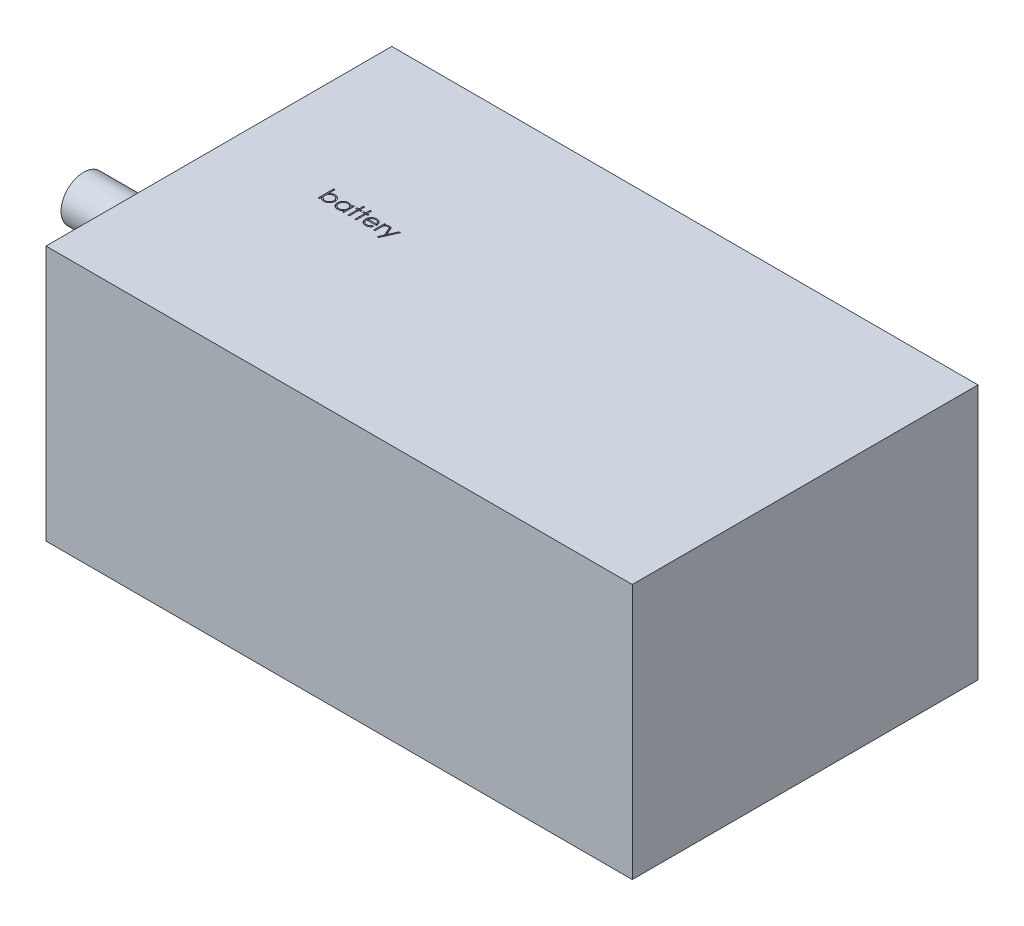
from build123d import *

# Parameters (mm, degrees)
SKETCH1_W           = 123.825
SKETCH1_H           = 73.025
BOSS_EXTRUDE1_DEPTH = 53.975
SKETCH2_R           = 4.7625
BOSS_EXTRUDE2_DEPTH = 31.75
CUT_EXTRUDE1_DEPTH  = 0.3175


with BuildPart() as part:
    # Sketch1 → Boss-Extrude1 (new body)
    with BuildSketch(Plane(origin=(0, 0, 0), x_dir=(1, 0, 0), z_dir=(0, 1, 0))):
        with Locations((61.9125, 36.5125)):
            Rectangle(SKETCH1_W, SKETCH1_H)
    extrude(amount=BOSS_EXTRUDE1_DEPTH)

    # Sketch2 → Boss-Extrude2 (add)
    with BuildSketch(Plane.ZY):
        with Locations((-39.6875, 26.9875)):
            Circle(SKETCH2_R)
    extrude(amount=BOSS_EXTRUDE2_DEPTH)

    # Sketch4 → Cut-Extrude1 (cut)
    # profile 1 of 7: a face of its own
    with BuildSketch(Plane(origin=(0, 53.975, 0), x_dir=(1, 0, 0), z_dir=(0, 1, 0))):
        with BuildLine():
            Line((19.930656416, 37.539911063), (19.930656416, 40.796321319))
            Line((19.930656416, 40.796321319), (20.215592314, 40.796321319))
            Line((20.215592314, 40.796321319), (20.215592314, 39.4390597))
            add(Edge.make_bspline(
                [(20.215592314, 39.4390597), (20.247699201, 39.476032967), (20.310341061, 39.548169335), (20.415366842, 39.642373989), (20.525499037, 39.722250164), (20.641575455, 39.788096143), (20.763761187, 39.838237201), (20.891425315, 39.874906083), (21.024894187, 39.897028488), (21.115898009, 39.899537712), (21.161986544, 39.900808498)],
                knots=[0, 0, 0, 0, 1.077089805, 2.101446609, 3.097517232, 4.067117542, 5.031729543, 5.997785507, 6.985986182, 8, 8, 8, 8], degree=3))
            add(Edge.make_bspline(
                [(21.161986544, 39.900808498), (21.202958684, 39.899683434), (21.283967586, 39.897458991), (21.403059248, 39.880554841), (21.517643433, 39.853142978), (21.627657771, 39.815140787), (21.73258892, 39.764719086), (21.83333535, 39.704356614), (21.9293809, 39.63247613), (22.019237832, 39.550290519), (22.102054429, 39.461067012), (22.174546492, 39.36565344), (22.235778359, 39.265436751), (22.286425317, 39.160752408), (22.325587629, 39.051172861), (22.352568115, 38.936805553), (22.369707186, 38.817762993), (22.371866409, 38.736743521), (22.372964108, 38.695555093)],
                knots=[0, 0, 0, 0, 1.034377878, 2.045141349, 3.03070803, 4.00595497, 4.978199603, 5.965204761, 6.967410914, 8.002051993, 9.036360596, 10.037508045, 11.022711142, 11.997267194, 12.969246472, 13.954813154, 14.960274251, 16, 16, 16, 16], degree=3))
            add(Edge.make_bspline(
                [(22.372964108, 38.695555093), (22.37184248, 38.655005791), (22.369630806, 38.575048954), (22.352738619, 38.457386578), (22.324847365, 38.344140044), (22.284968292, 38.235601982), (22.234835097, 38.131262489), (22.172141297, 38.03231098), (22.099741319, 37.937025623), (22.015983777, 37.848467043), (21.925347911, 37.766612459), (21.82836142, 37.695487138), (21.727467248, 37.634058037), (21.621092853, 37.58538488), (21.510813273, 37.546014045), (21.395447029, 37.518692997), (21.275646815, 37.502751725), (21.194258966, 37.500397175), (21.153082298, 37.499205934)],
                knots=[0, 0, 0, 0, 1.024244038, 2.01964794, 2.996620209, 3.965911562, 4.936179293, 5.91563013, 6.920572822, 7.955171681, 8.990768464, 10.002129126, 10.989675881, 11.969873457, 12.952483066, 13.943799762, 14.959703725, 16, 16, 16, 16], degree=3))
            add(Edge.make_bspline(
                [(21.153082298, 37.499205934), (21.105942517, 37.500512772), (21.013509627, 37.503075252), (20.878297567, 37.524319612), (20.750316447, 37.560479787), (20.628108385, 37.609067951), (20.513420379, 37.674861802), (20.405524279, 37.756465425), (20.305100506, 37.85522347), (20.245939537, 37.930572107), (20.215592314, 37.969222962)],
                knots=[0, 0, 0, 0, 1.035807596, 2.031038093, 2.998900396, 3.954262848, 4.914341711, 5.895762244, 6.92060972, 8, 8, 8, 8], degree=3))
            Line((20.215592314, 37.969222962), (20.215592314, 37.539911063))
            Line((20.215592314, 37.539911063), (19.930656416, 37.539911063))
        make_face()
        with BuildLine():
            add(Edge.make_bspline(
                [(21.150538227, 37.784141832), (21.192189104, 37.785623767), (21.27440131, 37.78854887), (21.395091034, 37.811384942), (21.51058321, 37.849379817), (21.620295863, 37.901344324), (21.722512096, 37.966678598), (21.813818414, 38.045732625), (21.894989294, 38.135994713), (21.962709119, 38.237806706), (22.019247926, 38.346165799), (22.058085684, 38.460152201), (22.084138574, 38.576715332), (22.086726016, 38.655769243), (22.088028211, 38.695555093)],
                knots=[0, 0, 0, 0, 1.031910345, 2.036826888, 3.032245421, 4.038315463, 5.03827337, 6.029480047, 7.023177075, 8.037597977, 9.052889626, 10.043399556, 11.015292101, 12, 12, 12, 12], degree=3))
            add(Edge.make_bspline(
                [(22.088028211, 38.695555093), (22.086315758, 38.735302049), (22.082897687, 38.814637281), (22.058971992, 38.93224805), (22.017190997, 39.046173967), (21.961748218, 39.156099713), (21.892925118, 39.258613932), (21.812183993, 39.350679976), (21.719762641, 39.430109391), (21.617415682, 39.496321812), (21.50839508, 39.550350835), (21.393650005, 39.587403108), (21.275577994, 39.611658464), (21.195390654, 39.614460745), (21.15499035, 39.615872601)],
                knots=[0, 0, 0, 0, 0.984795267, 1.965658976, 2.959410029, 3.983795688, 5.009594896, 6.01088574, 7.009236619, 8.019050059, 9.024672985, 10.014834719, 10.999826153, 12, 12, 12, 12], degree=3))
            add(Edge.make_bspline(
                [(21.15499035, 39.615872601), (21.113744826, 39.614461543), (21.031880829, 39.611660878), (20.911078227, 39.587360495), (20.793092248, 39.550124447), (20.680345701, 39.496665295), (20.575249523, 39.431249898), (20.481258081, 39.354378432), (20.400221597, 39.266585229), (20.333506891, 39.168154966), (20.280525395, 39.061851398), (20.242621566, 38.948447471), (20.219943315, 38.828540138), (20.217060295, 38.746322873), (20.215592314, 38.70445934)],
                knots=[0, 0, 0, 0, 1.016820015, 2.018181405, 3.029022337, 4.06341356, 5.088169224, 6.076823655, 7.05054209, 8.02560866, 9.001194327, 9.972267242, 10.967515442, 12, 12, 12, 12], degree=3))
            add(Edge.make_bspline(
                [(20.215592314, 38.70445934), (20.216462872, 38.67240289), (20.218176406, 38.609305653), (20.231266812, 38.516661248), (20.252090876, 38.428003371), (20.281431046, 38.343235411), (20.319985737, 38.262838569), (20.366440764, 38.186188554), (20.421732615, 38.113977009), (20.484240735, 38.046380968), (20.553149466, 37.984868142), (20.627102581, 37.931547895), (20.704588847, 37.885633594), (20.786494749, 37.849035058), (20.871867134, 37.819166), (20.961582058, 37.799450388), (21.054719707, 37.785865889), (21.118262431, 37.784722568), (21.150538227, 37.784141832)],
                knots=[0, 0, 0, 0, 1.050331198, 2.067384183, 3.060053655, 4.031335885, 5.001026174, 5.976994447, 6.963687968, 7.976578778, 8.990422448, 9.985569286, 10.960374351, 11.936812464, 12.921228065, 13.919088064, 14.943024695, 16, 16, 16, 16], degree=3))
        make_face(mode=Mode.SUBTRACT)
    # profile 2 of 7: a face of its own
    with BuildSketch(Plane(origin=(0, 53.975, 0), x_dir=(1, 0, 0), z_dir=(0, 1, 0))):
        with BuildLine():
            Line((25.303733339, 39.86010337), (25.303733339, 37.539911063))
            Line((25.303733339, 37.539911063), (25.018797442, 37.539911063))
            Line((25.018797442, 37.539911063), (25.018797442, 37.941238186))
            add(Edge.make_bspline(
                [(25.018797442, 37.941238186), (24.986667539, 37.904916554), (24.923965629, 37.834034433), (24.819244044, 37.74143132), (24.708238625, 37.664888128), (24.591488141, 37.603066419), (24.46909802, 37.556627911), (24.34133957, 37.523620466), (24.208160674, 37.502398916), (24.117217467, 37.50027981), (24.071131176, 37.499205934)],
                knots=[0, 0, 0, 0, 1.074387032, 2.096679803, 3.090159297, 4.057316773, 5.018401886, 5.985159533, 6.978961417, 8, 8, 8, 8], degree=3))
            add(Edge.make_bspline(
                [(24.071131176, 37.499205934), (24.030157389, 37.500318429), (23.949355268, 37.502512318), (23.830493176, 37.519532408), (23.716109493, 37.546865186), (23.60609613, 37.584875279), (23.50116497, 37.635295024), (23.400417596, 37.695657442), (23.30437594, 37.767540195), (23.214503901, 37.849716478), (23.131743444, 37.938974788), (23.059116432, 38.034175391), (22.998561853, 38.134906624), (22.947925065, 38.239893128), (22.908921238, 38.34994309), (22.88173087, 38.46467595), (22.864730608, 38.583956049), (22.862537626, 38.665181188), (22.861425647, 38.706367393)],
                knots=[0, 0, 0, 0, 1.033919861, 2.038935746, 3.024066025, 3.998881131, 4.97069526, 5.957263378, 6.95902576, 7.993208707, 9.027059324, 10.027763471, 11.009749337, 11.988697705, 12.965288445, 13.950418724, 14.960734635, 16, 16, 16, 16], degree=3))
            add(Edge.make_bspline(
                [(22.861425647, 38.706367393), (22.862562271, 38.746702324), (22.864809315, 38.826442307), (22.881549022, 38.943716554), (22.90969858, 39.056672405), (22.949202699, 39.164946203), (22.999859329, 39.268668963), (23.061479808, 39.367914043), (23.134068586, 39.462954854), (23.217754698, 39.551556609), (23.308409811, 39.633399595), (23.405391302, 39.704527801), (23.506286708, 39.765956656), (23.61266101, 39.814628024), (23.722939741, 39.854006283), (23.838104652, 39.881250476), (23.957676584, 39.897304474), (24.038857245, 39.899629268), (24.080035423, 39.900808498)],
                knots=[0, 0, 0, 0, 1.020392517, 2.01726096, 2.990465484, 3.961182959, 4.928053699, 5.906110375, 6.912531644, 7.948652711, 8.985773172, 9.998621852, 10.987621588, 11.969261332, 12.953316658, 13.946091881, 14.958173133, 16, 16, 16, 16], degree=3))
            add(Edge.make_bspline(
                [(24.080035423, 39.900808498), (24.127388152, 39.899504252), (24.220244619, 39.896946687), (24.356069313, 39.875662642), (24.48456109, 39.83970489), (24.606711823, 39.790794016), (24.722082874, 39.725798384), (24.82958201, 39.643810848), (24.93033427, 39.545348485), (24.988736392, 39.469719582), (25.018797442, 39.430791471)],
                knots=[0, 0, 0, 0, 1.038897134, 2.037228247, 3.008116434, 3.962042015, 4.918381754, 5.904844433, 6.921570401, 8, 8, 8, 8], degree=3))
            Line((25.018797442, 39.430791471), (25.018797442, 39.86010337))
            Line((25.018797442, 39.86010337), (25.303733339, 39.86010337))
        make_face()
        with BuildLine():
            add(Edge.make_bspline(
                [(24.083851528, 39.615872601), (24.042200665, 39.614390658), (23.959988485, 39.611465539), (23.839298569, 39.588629583), (23.723807114, 39.550634272), (23.614091747, 39.498671404), (23.511885579, 39.43333105), (23.420542035, 39.35429951), (23.339314013, 39.263733076), (23.270998659, 39.162040447), (23.215308708, 39.05302175), (23.176150043, 38.939062438), (23.150324369, 38.822217923), (23.147685925, 38.742967487), (23.146361544, 38.703187305)],
                knots=[0, 0, 0, 0, 1.031046209, 2.035121221, 3.029706178, 4.034933723, 5.034054252, 6.02443088, 7.017295772, 8.038157696, 9.050218397, 10.03989886, 11.016116709, 12, 12, 12, 12], degree=3))
            add(Edge.make_bspline(
                [(23.146361544, 38.703187305), (23.148053269, 38.66364485), (23.151430087, 38.584714934), (23.175696789, 38.467711126), (23.216409245, 38.353724959), (23.271964545, 38.243723915), (23.341530269, 38.141594052), (23.422164975, 38.049301227), (23.514648445, 37.969935672), (23.617089826, 37.90349873), (23.726498485, 37.849829872), (23.84155498, 37.812486756), (23.960096452, 37.788376912), (24.040698212, 37.785560708), (24.081307458, 37.784141832)],
                knots=[0, 0, 0, 0, 0.979072187, 1.954306742, 2.945804271, 3.96968567, 4.997920485, 5.998718438, 6.996577872, 8.005894225, 9.015743152, 10.005417472, 10.995077863, 12, 12, 12, 12], degree=3))
            add(Edge.make_bspline(
                [(24.081307458, 37.784141832), (24.122533928, 37.785647656), (24.204529289, 37.788642592), (24.32557726, 37.811576311), (24.44304769, 37.849466578), (24.55534039, 37.901989357), (24.659948595, 37.96708353), (24.753835955, 38.043289963), (24.833225441, 38.131920708), (24.900528737, 38.229326491), (24.95330215, 38.336108087), (24.99174329, 38.449804103), (25.014470761, 38.570418496), (25.017335273, 38.652845059), (25.018797442, 38.694919075)],
                knots=[0, 0, 0, 0, 1.01762866, 2.023962475, 3.030623092, 4.058876274, 5.077231937, 6.066672613, 7.034107872, 8.005628644, 8.981990164, 9.965428785, 10.961468474, 12, 12, 12, 12], degree=3))
            add(Edge.make_bspline(
                [(25.018797442, 38.694919075), (25.017926896, 38.726975536), (25.016213388, 38.790072795), (25.003122799, 38.882717043), (24.982299402, 38.971375494), (24.952956805, 39.056141362), (24.91441114, 39.136545983), (24.867922095, 39.21316668), (24.812672151, 39.28560495), (24.749550705, 39.352863308), (24.680457986, 39.41421017), (24.607347224, 39.46896916), (24.529352218, 39.513953261), (24.44778462, 39.551183557), (24.36250291, 39.580810071), (24.272813133, 39.600574622), (24.179668624, 39.614145771), (24.116126845, 39.61529093), (24.083851528, 39.615872601)],
                knots=[0, 0, 0, 0, 1.050140795, 2.067009409, 3.05949893, 4.030605086, 5.00011959, 5.97591094, 6.962425594, 7.979863591, 8.993523472, 9.986985069, 10.967611495, 11.937549037, 12.921786183, 13.919465291, 14.943216303, 16, 16, 16, 16], degree=3))
        make_face(mode=Mode.SUBTRACT)
    # profile 3 of 7: a face of its own
    with BuildSketch(Plane(origin=(0, 53.975, 0), x_dir=(1, 0, 0), z_dir=(0, 1, 0))):
        Polygon((26.239951288, 40.796321319), (26.524887185, 40.796321319), (26.524887185, 39.86010337), (26.931938467, 39.86010337), (26.931938467, 39.575167473), (26.524887185, 39.575167473), (26.524887185, 37.539911063), (26.239951288, 37.539911063), (26.239951288, 39.575167473), (25.832900006, 39.575167473), (25.832900006, 39.86010337), (26.239951288, 39.86010337), align=None)
    # profile 4 of 7: a face of its own
    with BuildSketch(Plane(origin=(0, 53.975, 0), x_dir=(1, 0, 0), z_dir=(0, 1, 0))):
        Polygon((27.705335903, 40.796321319), (27.990271801, 40.796321319), (27.990271801, 39.86010337), (28.397323083, 39.86010337), (28.397323083, 39.575167473), (27.990271801, 39.575167473), (27.990271801, 37.539911063), (27.705335903, 37.539911063), (27.705335903, 39.575167473), (27.298284621, 39.575167473), (27.298284621, 39.86010337), (27.705335903, 39.86010337), align=None)
    # profile 5 of 7: a face of its own
    with BuildSketch(Plane(origin=(0, 53.975, 0), x_dir=(1, 0, 0), z_dir=(0, 1, 0))):
        with BuildLine():
            Line((30.7900214, 38.27260337), (31.043156416, 38.139675686))
            add(Edge.make_bspline(
                [(31.043156416, 38.139675686), (31.022984648, 38.10389495), (30.983738374, 38.034279806), (30.916246267, 37.938638047), (30.845496316, 37.852597619), (30.768294859, 37.778457147), (30.68695165, 37.713821962), (30.601015599, 37.65727265), (30.510039314, 37.609086564), (30.414018493, 37.568489628), (30.312146757, 37.537275301), (30.204177239, 37.5152279), (30.089903096, 37.50159965), (30.011574776, 37.500016558), (29.971466713, 37.499205934)],
                knots=[0, 0, 0, 0, 1.120438281, 2.179929193, 3.190490725, 4.156257408, 5.095198341, 6.022838206, 6.959905092, 7.901321166, 8.864066838, 9.862729781, 10.905609505, 12, 12, 12, 12], degree=3))
            add(Edge.make_bspline(
                [(29.971466713, 37.499205934), (29.926887919, 37.500246586), (29.839927606, 37.502276597), (29.713345122, 37.519777618), (29.594165221, 37.548327543), (29.482394604, 37.58821057), (29.378306989, 37.640305357), (29.281695499, 37.703768601), (29.192052072, 37.77827429), (29.11220154, 37.864467778), (29.040316018, 37.956707839), (28.976883309, 38.052824963), (28.923854068, 38.152577316), (28.880717058, 38.255329863), (28.845878359, 38.360434966), (28.821597135, 38.468848941), (28.807600149, 38.580278363), (28.805455259, 38.655659518), (28.804374365, 38.69364704)],
                knots=[0, 0, 0, 0, 1.145258523, 2.234067595, 3.276747158, 4.290159414, 5.277019952, 6.260822364, 7.254936242, 8.264827045, 9.274100331, 10.257902744, 11.220704747, 12.172965371, 13.118907548, 14.062713208, 15.023725156, 16, 16, 16, 16], degree=3))
            add(Edge.make_bspline(
                [(28.804374365, 38.69364704), (28.805335157, 38.729293065), (28.807239321, 38.799938779), (28.819241536, 38.904501094), (28.840512487, 39.006126904), (28.86970101, 39.104900654), (28.907393926, 39.200656961), (28.95350601, 39.293454104), (29.008109096, 39.383193338), (29.05026645, 39.439801895), (29.071501769, 39.468316511)],
                knots=[0, 0, 0, 0, 1.024358464, 2.0301432, 3.019427413, 4.004406732, 4.986367066, 5.972626655, 6.978780325, 8, 8, 8, 8], degree=3))
            add(Edge.make_bspline(
                [(29.071501769, 39.468316511), (29.100265167, 39.502668986), (29.156880811, 39.570285737), (29.252635505, 39.65912979), (29.356322112, 39.733555214), (29.46664123, 39.795247402), (29.584875031, 39.842122782), (29.709434174, 39.87705466), (29.841736955, 39.896628999), (29.932183834, 39.899393819), (29.978462907, 39.900808498)],
                knots=[0, 0, 0, 0, 1.030682036, 2.02871468, 2.997146059, 3.962720338, 4.930598197, 5.918074684, 6.934738563, 8, 8, 8, 8], degree=3))
            add(Edge.make_bspline(
                [(29.978462907, 39.900808498), (30.026040377, 39.899580183), (30.119376529, 39.897170507), (30.255477096, 39.874830905), (30.384255746, 39.839404659), (30.505660946, 39.789372292), (30.619705005, 39.724820413), (30.725646636, 39.644863171), (30.825297651, 39.551955334), (30.883271862, 39.480505851), (30.912772802, 39.444147841)],
                knots=[0, 0, 0, 0, 1.056321875, 2.072262726, 3.055038591, 4.01806755, 4.982017516, 5.957941055, 6.960871419, 8, 8, 8, 8], degree=3))
            add(Edge.make_bspline(
                [(30.912772802, 39.444147841), (30.932845096, 39.416748878), (30.972856077, 39.362133328), (31.022973089, 39.273078064), (31.066477298, 39.179904882), (31.10125077, 39.081107684), (31.129408031, 38.977857065), (31.149779574, 38.869414899), (31.1617263, 38.755813479), (31.164074618, 38.678410104), (31.165271801, 38.638949524)],
                knots=[0, 0, 0, 0, 0.94817472, 1.890038105, 2.849395472, 3.817997239, 4.812318967, 5.836947057, 6.897266129, 8, 8, 8, 8], degree=3))
            Line((31.165271801, 38.638949524), (29.089310262, 38.638949524))
            add(Edge.make_bspline(
                [(29.089310262, 38.638949524), (29.090706905, 38.608378389), (29.093453347, 38.548261484), (29.106257799, 38.460295131), (29.126440615, 38.376499313), (29.154806122, 38.297502554), (29.18915676, 38.222273081), (29.231235232, 38.151368947), (29.281436113, 38.085113111), (29.33743014, 38.022912922), (29.399757291, 37.967522088), (29.465328069, 37.91794512), (29.535081517, 37.8763929), (29.608467635, 37.842665428), (29.685367755, 37.816261842), (29.765806103, 37.79823889), (29.849624394, 37.786167443), (29.906761453, 37.784825175), (29.935849725, 37.784141832)],
                knots=[0, 0, 0, 0, 1.094153842, 2.151609401, 3.174256925, 4.172055639, 5.149267565, 6.128595816, 7.11444997, 8.118368179, 9.117203808, 10.09244225, 11.054858984, 12.015122123, 12.976791628, 13.957293641, 14.960065497, 16, 16, 16, 16], degree=3))
            add(Edge.make_bspline(
                [(29.935849725, 37.784141832), (29.964289695, 37.784693426), (30.02072005, 37.785787895), (30.104758542, 37.796430414), (30.187435114, 37.813639164), (30.268407577, 37.837125084), (30.346032559, 37.865769799), (30.417919593, 37.900334535), (30.484032361, 37.938570376), (30.54582418, 37.982303439), (30.60576001, 38.035832294), (30.665216408, 38.102630412), (30.728967372, 38.181631241), (30.768872217, 38.241090524), (30.7900214, 38.27260337)],
                knots=[0, 0, 0, 0, 0.99110716, 1.966546729, 2.947904876, 3.932708344, 4.903319531, 5.828989031, 6.710028674, 7.56322171, 8.463672341, 9.504779593, 10.677557249, 12, 12, 12, 12], degree=3))
        make_face()
        with BuildLine():
            add(Edge.make_bspline(
                [(30.880335903, 38.923885422), (30.869906823, 38.9616796), (30.849834199, 39.034421227), (30.807891211, 39.135151178), (30.760654885, 39.224675202), (30.704755172, 39.302308155), (30.641419613, 39.371254199), (30.568262912, 39.431505344), (30.486224637, 39.48540546), (30.395728845, 39.530900942), (30.299896655, 39.569626742), (30.199561037, 39.595593812), (30.097182901, 39.613382468), (30.027936799, 39.615039009), (29.993091312, 39.615872601)],
                knots=[0, 0, 0, 0, 1.154881502, 2.222775134, 3.210006277, 4.132804581, 5.035138423, 5.962687519, 6.919655026, 7.923214229, 8.944639381, 9.960483929, 10.97369054, 12, 12, 12, 12], degree=3))
            add(Edge.make_bspline(
                [(29.993091312, 39.615872601), (29.964652893, 39.615317728), (29.908436117, 39.614220859), (29.825613005, 39.603815813), (29.746074992, 39.586616526), (29.669235196, 39.563062601), (29.596100551, 39.531667654), (29.525166725, 39.49485287), (29.458237366, 39.449911576), (29.416380619, 39.415658901), (29.395234741, 39.398354572)],
                knots=[0, 0, 0, 0, 1.04873581, 2.073130211, 3.073294108, 4.04793562, 5.032784715, 6.005352987, 6.992311501, 8, 8, 8, 8], degree=3))
            add(Edge.make_bspline(
                [(29.395234741, 39.398354572), (29.38009155, 39.384661872), (29.349445421, 39.356951183), (29.308496519, 39.309208974), (29.269289376, 39.2577272), (29.233608134, 39.200536265), (29.200880609, 39.138287416), (29.170255487, 39.071505704), (29.142690671, 38.999684364), (29.127182056, 38.94963508), (29.119203091, 38.923885422)],
                knots=[0, 0, 0, 0, 0.879870761, 1.780643979, 2.707998968, 3.669668524, 4.684282772, 5.740141944, 6.837334558, 8, 8, 8, 8], degree=3))
            Line((29.119203091, 38.923885422), (30.880335903, 38.923885422))
        make_face(mode=Mode.SUBTRACT)
    # profile 6 of 7: a face of its own
    with BuildSketch(Plane(origin=(0, 53.975, 0), x_dir=(1, 0, 0), z_dir=(0, 1, 0))):
        with BuildLine():
            Line((31.653733339, 39.86010337), (31.938669237, 39.86010337))
            Line((31.938669237, 39.86010337), (31.938669237, 39.518561904))
            add(Edge.make_bspline(
                [(31.938669237, 39.518561904), (31.959704754, 39.550362548), (31.999935016, 39.611181033), (32.066803173, 39.691616756), (32.135295481, 39.758214691), (32.20573983, 39.811285741), (32.278654249, 39.851030498), (32.352438484, 39.880143466), (32.428253374, 39.897358602), (32.479200263, 39.899656992), (32.504724926, 39.900808498)],
                knots=[0, 0, 0, 0, 1.2804753, 2.448899062, 3.506932113, 4.484331642, 5.4025378, 6.288909075, 7.142734305, 8, 8, 8, 8], degree=3))
            add(Edge.make_bspline(
                [(32.504724926, 39.900808498), (32.524524522, 39.899728521), (32.565263478, 39.897506396), (32.626933399, 39.88189372), (32.690472816, 39.856967228), (32.73142341, 39.833526455), (32.752771801, 39.821306295)],
                knots=[0, 0, 0, 0, 0.901110191, 1.854092781, 2.881294221, 4, 4, 4, 4], degree=3))
            Line((32.752771801, 39.821306295), (32.596311464, 39.574531455))
            add(Edge.make_bspline(
                [(32.596311464, 39.574531455), (32.582605424, 39.580645839), (32.556588735, 39.592252111), (32.51852995, 39.605988078), (32.483440451, 39.614076087), (32.461085223, 39.615301381), (32.450663427, 39.615872601)],
                knots=[0, 0, 0, 0, 1.180555205, 2.24091978, 3.179933427, 4, 4, 4, 4], degree=3))
            add(Edge.make_bspline(
                [(32.450663427, 39.615872601), (32.427798226, 39.614348567), (32.381159844, 39.61123998), (32.312684619, 39.586802633), (32.24623894, 39.547319022), (32.193468932, 39.503530228), (32.152609174, 39.461304726), (32.123453398, 39.424430818), (32.096708335, 39.383084488), (32.071153921, 39.33797256), (32.047870925, 39.288324771), (32.026140618, 39.234637142), (32.006492935, 39.176847489), (31.9952895, 39.136586203), (31.989550647, 39.115962745)],
                knots=[0, 0, 0, 0, 1.125678352, 2.296057538, 3.5422874, 4.923748041, 5.663163013, 6.437101912, 7.23742474, 8.08941207, 8.991984279, 9.93940061, 10.944477711, 12, 12, 12, 12], degree=3))
            add(Edge.make_bspline(
                [(31.989550647, 39.115962745), (31.98525769, 39.097568452), (31.975749117, 39.05682649), (31.966503936, 38.988474614), (31.957369445, 38.907717438), (31.950931798, 38.814330172), (31.944964574, 38.708546026), (31.941599, 38.590203847), (31.938784008, 38.459182164), (31.938708654, 38.367584001), (31.938669237, 38.319668675)],
                knots=[0, 0, 0, 0, 0.566838948, 1.255505196, 2.06880316, 3.007127437, 4.065329342, 5.249902469, 6.561414163, 8, 8, 8, 8], degree=3))
            Line((31.938669237, 38.319668675), (31.938669237, 37.539911063))
            Line((31.938669237, 37.539911063), (31.653733339, 37.539911063))
            Line((31.653733339, 37.539911063), (31.653733339, 39.86010337))
        make_face()
    # profile 7 of 7: a face of its own
    with BuildSketch(Plane(origin=(0, 53.975, 0), x_dir=(1, 0, 0), z_dir=(0, 1, 0))):
        Polygon((32.793476929, 39.86010337), (33.100673443, 39.86010337), (33.886155214, 38.083070117), (34.68372132, 39.86010337), (34.991553852, 39.86010337), (33.566874365, 36.68510337), (33.259041833, 36.68510337), (33.731602931, 37.737712545), align=None)
    extrude(amount=-CUT_EXTRUDE1_DEPTH, mode=Mode.SUBTRACT)


solid = part.part
